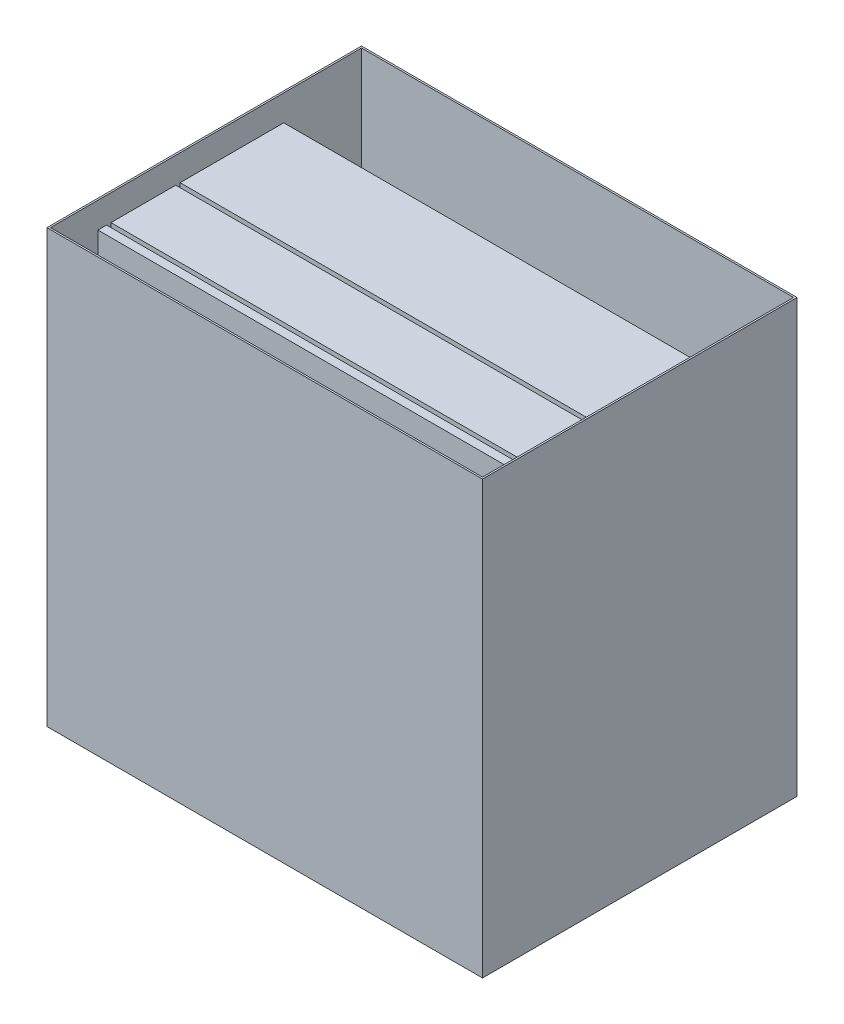
from build123d import *

# Parameters (mm, degrees)
SKETCH1_W           = 609.6
SKETCH1_H           = 609.6
BOSS_EXTRUDE1_DEPTH = 152.4
BOSS_EXTRUDE2_START = 6.35
SKETCH2_W           = 609.6
SKETCH2_H           = 609.6
BOSS_EXTRUDE2_DEPTH = 95.25
BOSS_EXTRUDE3_START = 6.35
SKETCH3_W           = 609.6
SKETCH3_H           = 609.6
BOSS_EXTRUDE3_DEPTH = 12.7
SKETCH4_W           = 640.08
SKETCH4_H           = 462.28
SKETCH4_W_2         = 635
SKETCH4_H_2         = 457.2
EXTRUDE_THIN1_DEPTH = 635


with BuildPart() as part:
    # Sketch1 → Boss-Extrude1 (new body)
    with BuildSketch(Plane.XY):
        Rectangle(SKETCH1_W, SKETCH1_H)
    extrude(amount=BOSS_EXTRUDE1_DEPTH)


with BuildPart() as body_2:
    # Sketch2 → Boss-Extrude2 (new body)
    with BuildSketch(Plane.XY.offset(152.4).offset(BOSS_EXTRUDE2_START)):
        Rectangle(SKETCH2_W, SKETCH2_H)
    extrude(amount=BOSS_EXTRUDE2_DEPTH)


with BuildPart() as body_3:
    # Sketch3 → Boss-Extrude3 (new body)
    with BuildSketch(Plane.XY.offset(254).offset(BOSS_EXTRUDE3_START)):
        Rectangle(SKETCH3_W, SKETCH3_H)
    extrude(amount=BOSS_EXTRUDE3_DEPTH)


with BuildPart() as body_4:
    # Sketch4 → Extrude-Thin1 (new body)
    with BuildSketch(Plane.XZ.offset(304.8)):
        with Locations((0, 101.647614288)):
            Rectangle(SKETCH4_W, SKETCH4_H)
        with Locations((0, 101.647614288)):
            Rectangle(SKETCH4_W_2, SKETCH4_H_2, mode=Mode.SUBTRACT)
    extrude(amount=-EXTRUDE_THIN1_DEPTH)


solid = Compound([part.part, body_2.part, body_3.part, body_4.part])
